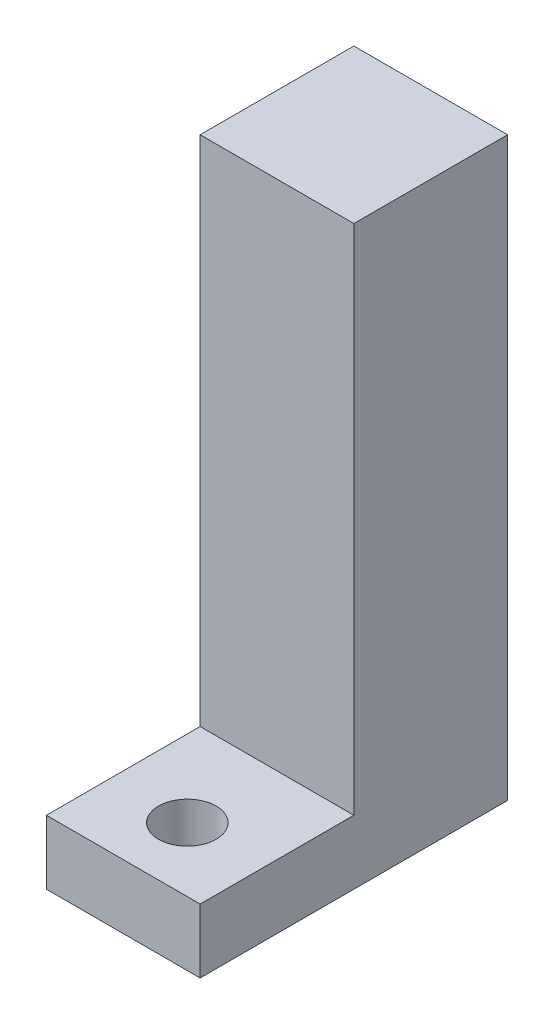
from build123d import *

# Parameters (mm, degrees)
LEG_START          = -45
SKETCH1_W          = 12
SKETCH1_H          = 12
LEG_DEPTH          = 45
FOOT_PAD_START     = -45
SKETCH2_W          = 12
SKETCH2_H          = 18
FOOT_PAD_DEPTH     = 5
FOOT_HOLE_M4_START = -45.5
SKETCH3_R          = 2.25
FOOT_HOLE_M4_DEPTH = 6


with BuildPart() as part:
    # Sketch1 → Leg (new body)
    with BuildSketch(Plane(origin=(0, 0, 0), x_dir=(1, 0, 0), z_dir=(0, 1, 0)).offset(LEG_START)):
        Rectangle(SKETCH1_W, SKETCH1_H)
    extrude(amount=LEG_DEPTH)

    # Sketch2 → Foot_Pad (add)
    with BuildSketch(Plane(origin=(0, 0, 0), x_dir=(1, 0, 0), z_dir=(0, 1, 0)).offset(FOOT_PAD_START)):
        with Locations((0, -9)):
            Rectangle(SKETCH2_W, SKETCH2_H)
    extrude(amount=FOOT_PAD_DEPTH)

    # Sketch3 → Foot_Hole_M4 (cut)
    with BuildSketch(Plane(origin=(0, 0, 0), x_dir=(1, 0, 0), z_dir=(0, 1, 0)).offset(FOOT_HOLE_M4_START)):
        with Locations(Location((0, -13, 0), (0, 0, 270))):
            Circle(SKETCH3_R)
    extrude(amount=FOOT_HOLE_M4_DEPTH, mode=Mode.SUBTRACT)


solid = part.part
